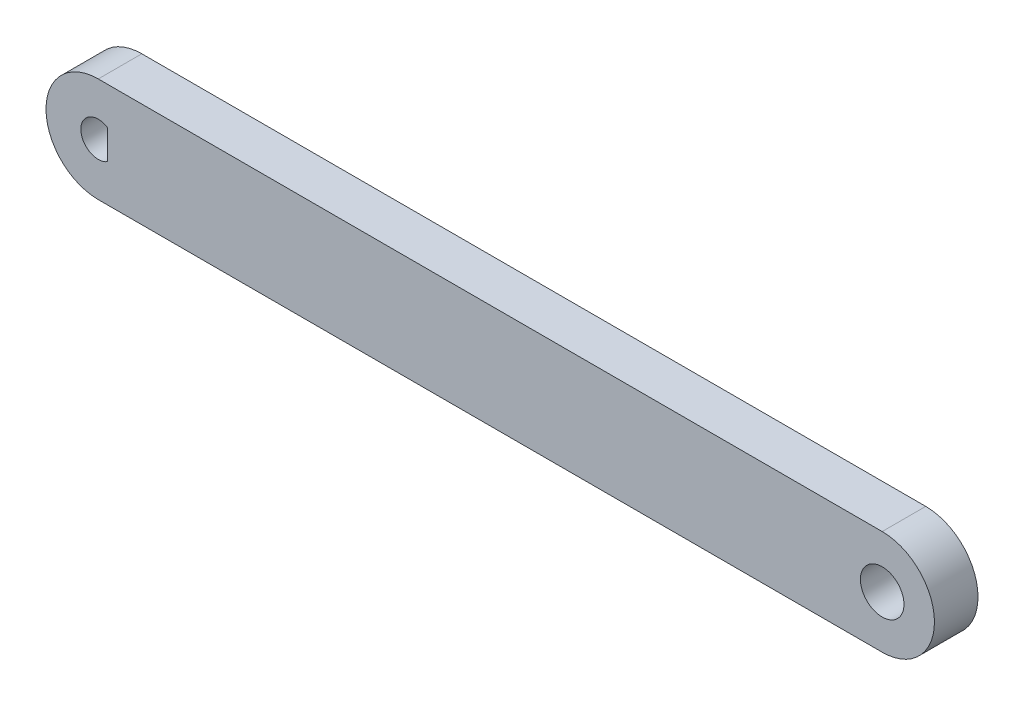
from build123d import *

# Parameters (mm, degrees)
CROQUIS1_R              = 2.5
SALIENTE_EXTRUIR1_DEPTH = 2.5
CROQUIS3_R              = 2.5
CROQUIS3_R_2            = 2
SALIENTE_EXTRUIR7_DEPTH = 5


with BuildPart() as part:
    # Croquis1 → Saliente-Extruir1 (new, symmetric)
    with BuildSketch(Plane.XY):
        with BuildLine():
            Line((-45, 6), (45, 6))
            ThreePointArc((45, 6), (51, 0), (45, -6))
            Line((45, -6), (-45, -6))
            ThreePointArc((-45, -6), (-51, 0), (-45, 6))
        make_face()
        with Locations((45, 0)):
            Circle(CROQUIS1_R, mode=Mode.SUBTRACT)
        with Locations((-45, 0)):
            Circle(CROQUIS1_R, mode=Mode.SUBTRACT)
    extrude(amount=SALIENTE_EXTRUIR1_DEPTH, both=True)

    # Croquis3 → Saliente-Extruir7 (add, through all)
    # profile 1 of 2: a face of its own
    with BuildSketch(Plane.XY.offset(2.5)):
        with Locations((-45, 0)):
            Circle(CROQUIS3_R)
        with Locations((-45, 0)):
            Circle(CROQUIS3_R_2, mode=Mode.SUBTRACT)
    # profile 2 of 2: a face of its own
    with BuildSketch(Plane.XY.offset(2.5)):
        with BuildLine():
            Line((-43.934051012, 1.692262614), (-43.934051012, 0))
            Line((-43.934051012, 0), (-43.934051012, -1.692262614))
            ThreePointArc((-43.934051012, -1.692262614), (-43.249014852, -0.966463146), (-43, 0))
            ThreePointArc((-43, 0), (-43.249014852, 0.966463146), (-43.934051012, 1.692262614))
        make_face()
    extrude(amount=-SALIENTE_EXTRUIR7_DEPTH)


solid = part.part
